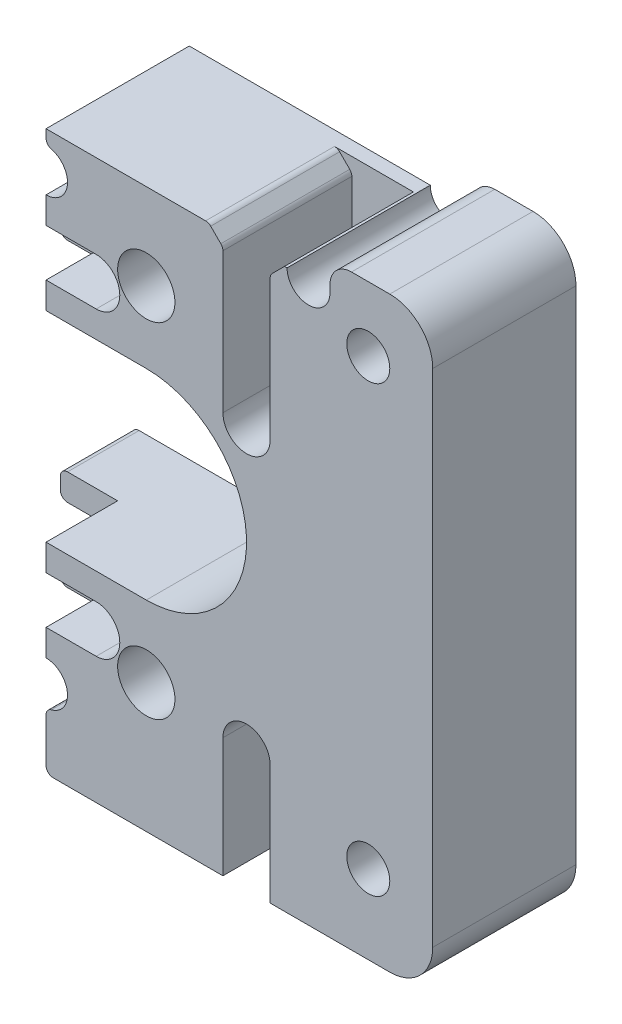
from build123d import *

# Parameters (mm, degrees)
BOSS_EXTRUDE5_DEPTH = 10
SKETCH32_W          = 5
SKETCH32_H          = 7
BOSS_EXTRUDE6_DEPTH = 4
SKETCH15_R          = 2
SKETCH15_R_2        = 1.5
CUT_EXTRUDE8_DEPTH  = 51.921508226
CUT_EXTRUDE18_DEPTH = 9
CUT_EXTRUDE19_DEPTH = 51.921508226
SKETCH20_W          = 18.573206134
SKETCH20_H          = 9.890954849
CUT_EXTRUDE12_DEPTH = 51.921508226
SKETCH28_W          = 11
SKETCH28_H          = 1
CUT_EXTRUDE15_DEPTH = 10
SKETCH37_W          = 7
SKETCH37_H          = 5
BOSS_EXTRUDE7_DEPTH = 1
CUT_EXTRUDE11_DEPTH = 9
CUT_EXTRUDE20_DEPTH = 52.749396132
BOSS_EXTRUDE8_START = -1
BOSS_EXTRUDE8_DEPTH = 1
FILLET15_R          = 3
FILLET16_R          = 0.5


with BuildPart() as part:
    # Sketch14 → Boss-Extrude5 (new body)
    with BuildSketch(Plane.XY):
        with BuildLine():
            Line((27, -8.5), (27, 0))
            Line((27, 0), (0, 0))
            Line((0, 0), (0, -14))
            Line((0, -14), (7, -14))
            ThreePointArc((7, -14), (14, -21), (7, -28))
            Line((7, -28), (0, -28))
            Line((0, -28), (0, -42))
            Line((0, -42), (27, -42))
            Line((27, -42), (27, -33.5))
            Line((27, -33.5), (27, -8.5))
        make_face()
    extrude(amount=BOSS_EXTRUDE5_DEPTH)

    # Sketch32 → Boss-Extrude6 (add)
    with BuildSketch(Plane.ZY):
        with Locations((2.5, -10.5)):
            Rectangle(SKETCH32_W, SKETCH32_H)
        with Locations((2.5, -31.5)):
            Rectangle(SKETCH32_W, SKETCH32_H)
    extrude(amount=BOSS_EXTRUDE6_DEPTH)

    # Sketch15 → Cut-Extrude8 (cut, through all)
    with BuildSketch(Plane.XY.offset(10)):
        with Locations((7, -9)):
            Circle(SKETCH15_R)
        with Locations((22.5, -5.5)):
            Circle(SKETCH15_R_2)
        with Locations((22.5, -36.5)):
            Circle(SKETCH15_R_2)
        with Locations((7, -33)):
            Circle(SKETCH15_R)
        with Locations((-8.5, -36.5)):
            Circle(SKETCH15_R_2)
    extrude(amount=-CUT_EXTRUDE8_DEPTH, mode=Mode.SUBTRACT)

    # Sketch33 → Cut-Extrude18 (cut)
    with BuildSketch(Plane.XY.offset(10)):
        with BuildLine():
            Line((-4, -29.85), (3.5, -29.85))
            ThreePointArc((3.5, -29.85), (5.15, -31.5), (3.5, -33.15))
            Line((3.5, -33.15), (-4, -33.15))
            ThreePointArc((-4, -33.15), (-5.65, -31.5), (-4, -29.85))
        make_face()
        with BuildLine():
            Line((-4, -12.15), (3.5, -12.15))
            ThreePointArc((3.5, -12.15), (5.15, -10.5), (3.5, -8.85))
            Line((3.5, -8.85), (-4, -8.85))
            ThreePointArc((-4, -8.85), (-5.65, -10.5), (-4, -12.15))
        make_face()
    extrude(amount=-CUT_EXTRUDE18_DEPTH, mode=Mode.SUBTRACT)

    # Sketch34 → Cut-Extrude19 (cut, through all)
    with BuildSketch(Plane.XY.offset(10)):
        with BuildLine():
            Line((0, -7), (-4.5, -7))
            ThreePointArc((-4.5, -7), (-6, -5.5), (-4.5, -4))
            Line((-4.5, -4), (0, -4))
            ThreePointArc((0, -4), (1.5, -5.5), (0, -7))
        make_face()
        with BuildLine():
            Line((0, -38), (-4, -38))
            ThreePointArc((-4, -38), (-5.5, -36.5), (-4, -35))
            Line((-4, -35), (0, -35))
            ThreePointArc((0, -35), (1.5, -36.5), (0, -38))
        make_face()
    extrude(amount=-CUT_EXTRUDE19_DEPTH, mode=Mode.SUBTRACT)

    # Sketch20 → Cut-Extrude12 (cut, through all)
    with BuildSketch(Plane.XY.offset(10)):
        with Locations((6.713396933, 2.275477425)):
            Rectangle(SKETCH20_W, SKETCH20_H)
    extrude(amount=-CUT_EXTRUDE12_DEPTH, mode=Mode.SUBTRACT)

    # Sketch28 → Cut-Extrude15 (cut)
    with BuildSketch(Plane.XY.offset(10)):
        with Locations((21.5, -0.5)):
            Rectangle(SKETCH28_W, SKETCH28_H)
    extrude(amount=-CUT_EXTRUDE15_DEPTH, mode=Mode.SUBTRACT)

    # Sketch37 → Boss-Extrude7 (add)
    with BuildSketch(Plane.XZ.offset(42)):
        with Locations((14, 2.5)):
            Rectangle(SKETCH37_W, SKETCH37_H)
    extrude(amount=BOSS_EXTRUDE7_DEPTH)

    # Sketch19 → Cut-Extrude11 (cut)
    with BuildSketch(Plane.XY.offset(10)):
        with BuildLine():
            Line((15.65, -33.65), (15.65, -43))
            ThreePointArc((15.65, -43), (14, -44.65), (12.35, -43))
            Line((12.35, -43), (12.35, -33.65))
            ThreePointArc((12.35, -33.65), (14, -32), (15.65, -33.65))
        make_face()
    extrude(amount=-CUT_EXTRUDE11_DEPTH, mode=Mode.SUBTRACT)

    # Sketch35 → Cut-Extrude20 (cut, through all)
    with BuildSketch(Plane.XY.offset(10)):
        with BuildLine():
            Line((11.35, -3), (12.35, -4))
            Line((12.35, -4), (12.35, -14))
            ThreePointArc((12.35, -14), (14, -15.65), (15.65, -14))
            Line((15.65, -14), (15.65, -4))
            Line((15.65, -4), (16.65, -3))
            Line((16.65, -3), (16.828427125, -3))
            ThreePointArc((16.828427125, -3), (18.328427125, -4.5), (19.828427125, -3))
            Line((19.828427125, -3), (19.828427125, -2.5))
            ThreePointArc((19.828427125, -2.5), (20.267766953, -1.439339828), (21.328427125, -1))
            Line((21.328427125, -1), (16, -1))
            Line((16, -1), (16, -2.67))
            Line((16, -2.67), (0, -2.67))
            Line((0, -2.67), (0, -3))
            Line((0, -3), (11.35, -3))
        make_face()
    extrude(amount=-CUT_EXTRUDE20_DEPTH, mode=Mode.SUBTRACT)

    # Sketch39 → Boss-Extrude8 (add)
    with BuildSketch(Plane(origin=(0, 0, 0), x_dir=(-1, 0, 0), z_dir=(0, 0, -1)).offset(BOSS_EXTRUDE8_START)):
        with BuildLine():
            Line((-15.65, -4), (-16.65, -3))
            Line((-16.65, -3), (-11.35, -3))
            Line((-11.35, -3), (-12.35, -4))
            Line((-12.35, -4), (-12.35, -14))
            ThreePointArc((-12.35, -14), (-14, -15.65), (-15.65, -14))
            Line((-15.65, -14), (-15.65, -4))
        make_face()
    extrude(amount=BOSS_EXTRUDE8_DEPTH)

    # Fillet15
    fillet15_edges = [part.edges().sort_by_distance(p)[0] for p in [
        (27, -42, 5),
        (27, -1, 5),
    ]]
    fillet(fillet15_edges, radius=FILLET15_R)

    # Fillet16
    fillet16_edges = [part.edges().sort_by_distance(p)[0] for p in [
        (0, -42, 5),
        (-4, -35, 2.5),
        (-4, -33.15, 3),
        (-4, -29.85, 3),
        (-4, -28, 2.5),
        (-4, -14, 2.5),
        (-4, -7, 2.5),
        (-4, -12.15, 3),
        (-4, -8.85, 3),
        (0, -4, 5),
        (0, -38, 5),
        (10.5, -43, 2.5),
        (17.5, -43, 2.5),
        (15.65, -43, 3),
        (12.35, -43, 3),
        (15.65, -4, 5.5),
        (12.35, -4, 5.5),
        (11.35, -3, 5.5),
    ]]
    fillet(fillet16_edges, radius=FILLET16_R)


solid = part.part
